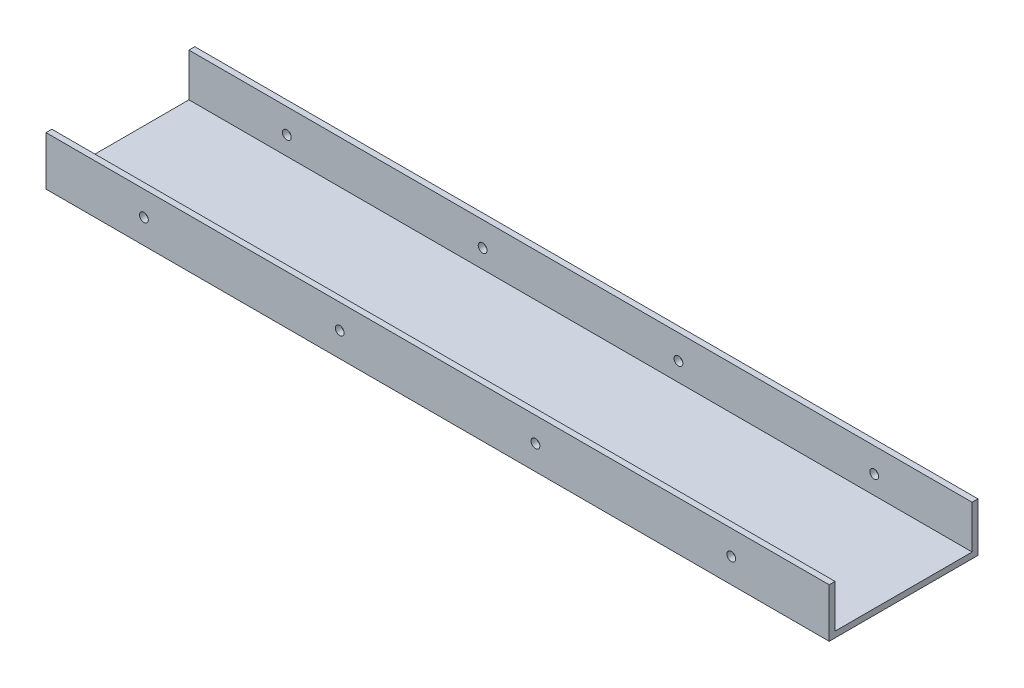
from build123d import *

# Parameters (mm, degrees)
ESBO_O1_W                = 400
ESBO_O1_H                = 76
RESSALTO_EXTRUS_O1_DEPTH = 3
ESBO_O2_W                = 400
ESBO_O2_H                = 3
RESSALTO_EXTRUS_O2_DEPTH = 22
FURO_COM_FOLGA_DE_M41_D  = 4.5


with BuildPart() as part:
    # Esboço1 → Ressalto-extrusão1 (new body)
    with BuildSketch(Plane(origin=(0, 0, 0), x_dir=(1, 0, 0), z_dir=(0, 1, 0))):
        Rectangle(ESBO_O1_W, ESBO_O1_H)
    extrude(amount=RESSALTO_EXTRUS_O1_DEPTH)

    # Esboço2 → Ressalto-extrusão2 (add)
    with BuildSketch(Plane(origin=(0, 3, 0), x_dir=(1, 0, 0), z_dir=(0, 1, 0))):
        with Locations((0, 36.5)):
            Rectangle(ESBO_O2_W, ESBO_O2_H)
        with Locations((0, -36.5)):
            Rectangle(ESBO_O2_W, ESBO_O2_H)
    extrude(amount=RESSALTO_EXTRUS_O2_DEPTH)

    # Furo com folga de M41 (through all)
    with Locations(Plane(origin=(-150, 12.5, 38), x_dir=(1, 0, 0), z_dir=(0, 0, 1))):
        with Locations((0, 0), (300, 0), (100, 0), (200, 0)):
            Hole(FURO_COM_FOLGA_DE_M41_D / 2)


solid = part.part
